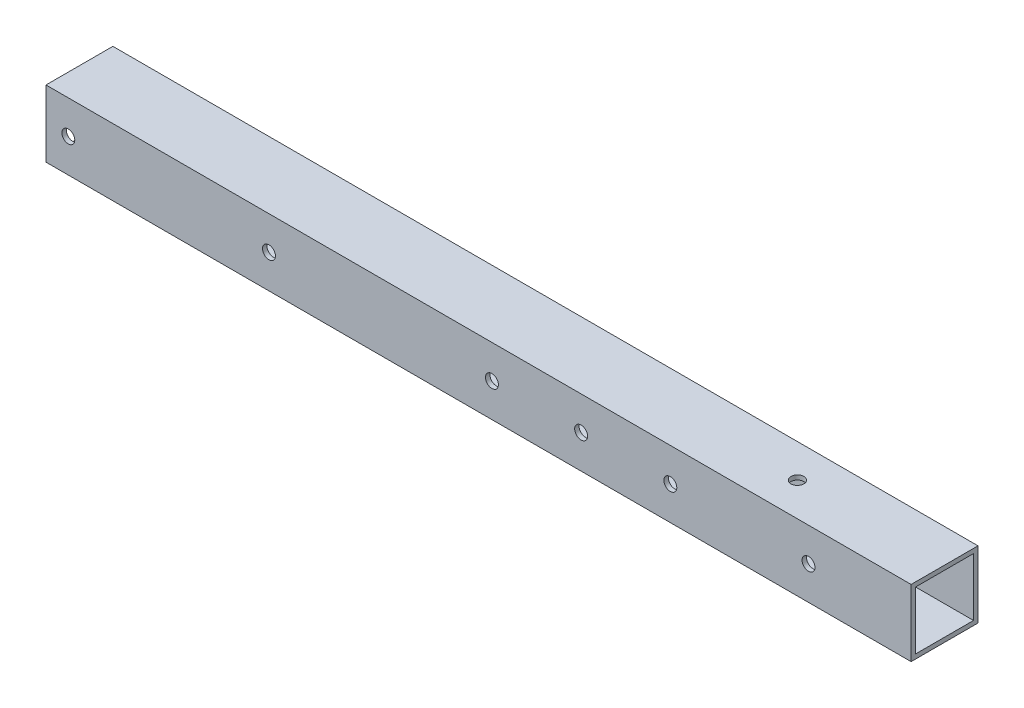
from build123d import *

# Parameters (mm, degrees)
SKETCH_11_W         = 15
SKETCH_11_H         = 15
SKETCH_11_W_2       = 13
SKETCH_11_H_2       = 13
F_15X15X1_1_DEPTH   = 194
SKETCH_12_R         = 1.45
CUT_EXTRUDE_1_DEPTH = 195.723521948
SKETCH_13_R         = 1.45
CUT_EXTRUDE_2_DEPTH = 195.723521948
SKETCH_14_R         = 1.45
CUT_EXTRUDE_3_DEPTH = 195.723521948
SKETCH_15_R         = 1.45
CUT_EXTRUDE_4_DEPTH = 195.723521948


with BuildPart() as part:
    # 草图11 → 铝管 15X15X1(1) (new body)
    with BuildSketch(Plane(origin=(0, 0, 0), x_dir=(0, 0, -1), z_dir=(1, 0, 0))):
        Rectangle(SKETCH_11_W, SKETCH_11_H)
        Rectangle(SKETCH_11_W_2, SKETCH_11_H_2, mode=Mode.SUBTRACT)
    extrude(amount=F_15X15X1_1_DEPTH)

    # 草图12 → 切除-拉伸1 (cut, through all)
    with BuildSketch(Plane(origin=(0, 0, -7.5), x_dir=(-1, 0, 0), z_dir=(0, 0, -1))):
        with Locations((-5, 0)):
            Circle(SKETCH_12_R)
        with Locations((-50, 0)):
            Circle(SKETCH_12_R)
    extrude(amount=-CUT_EXTRUDE_1_DEPTH, mode=Mode.SUBTRACT)

    # 草图13 → 切除-拉伸2 (cut, through all)
    with BuildSketch(Plane(origin=(0, 0, -7.5), x_dir=(-1, 0, 0), z_dir=(0, 0, -1))):
        with Locations((-171, 0)):
            Circle(SKETCH_13_R)
    extrude(amount=-CUT_EXTRUDE_2_DEPTH, mode=Mode.SUBTRACT)

    # 草图14 → 切除-拉伸3 (cut, through all)
    with BuildSketch(Plane(origin=(0, 7.5, 0), x_dir=(1, 0, 0), z_dir=(0, 1, 0))):
        with Locations(Location((161, 0, 0), (0, 0, 270))):
            Circle(SKETCH_14_R)
    extrude(amount=-CUT_EXTRUDE_3_DEPTH, mode=Mode.SUBTRACT)

    # 草图15 → 切除-拉伸4 (cut, through all)
    with BuildSketch(Plane(origin=(0, 0, -7.5), x_dir=(-1, 0, 0), z_dir=(0, 0, -1))):
        with Locations((-120, 0)):
            Circle(SKETCH_15_R)
        with Locations((-140, 0)):
            Circle(SKETCH_15_R)
        with Locations((-100, 0)):
            Circle(SKETCH_15_R)
    extrude(amount=-CUT_EXTRUDE_4_DEPTH, mode=Mode.SUBTRACT)


solid = part.part
